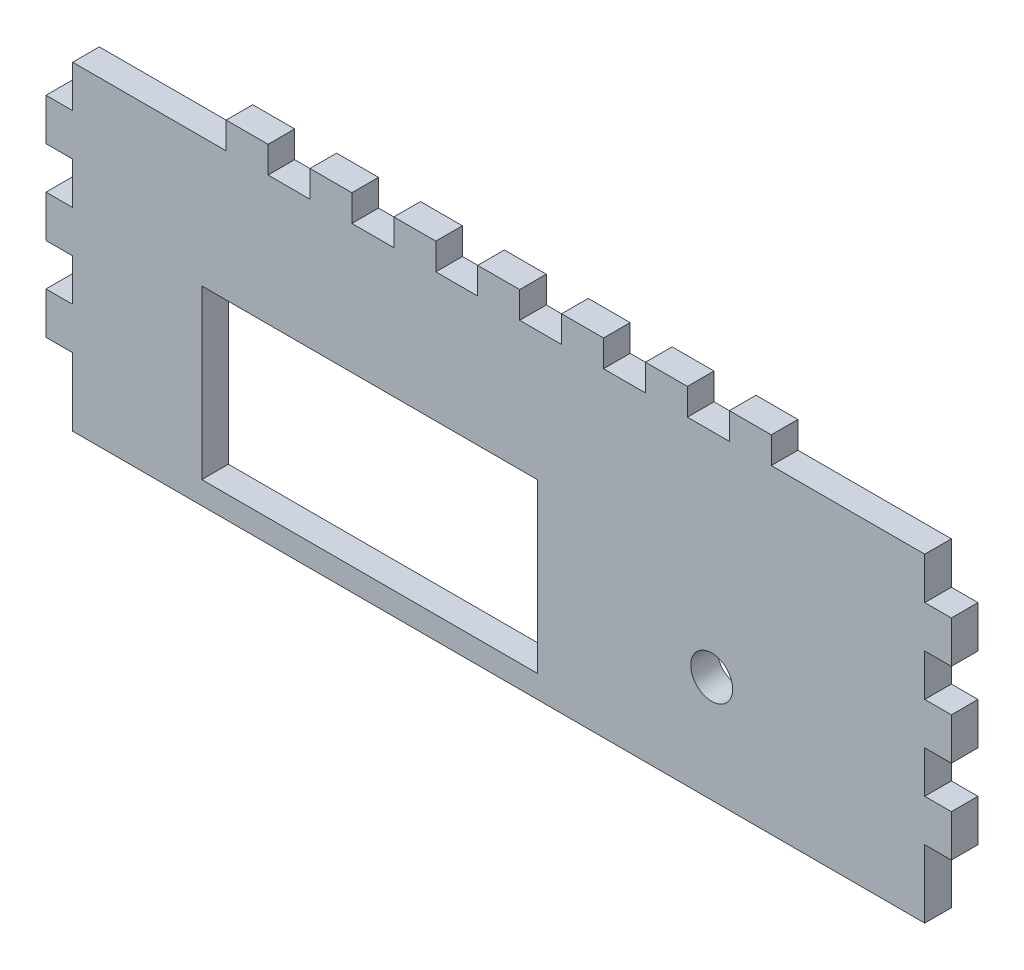
from build123d import *

# Parameters (mm, degrees)
SKETCH1_R           = 2.5
SKETCH1_W           = 40
SKETCH1_H           = 20
BOSS_EXTRUDE1_DEPTH = 3.175


with BuildPart() as part:
    # Sketch1 → Boss-Extrude1 (new body)
    with BuildSketch(Plane.XY):
        Polygon((-101.6, 0), (-83.3, 0), (-83.3, 3.175), (-78.3, 3.175), (-78.3, 0), (-73.3, 0), (-73.3, 3.175), (-68.3, 3.175), (-68.3, 0), (-63.3, 0), (-63.3, 3.175), (-58.3, 3.175), (-58.3, 0), (-53.3, 0), (-53.3, 3.175), (-48.3, 3.175), (-48.3, 0), (-43.3, 0), (-43.3, 3.175), (-38.3, 3.175), (-38.3, 0), (-33.3, 0), (-33.3, 3.175), (-28.3, 3.175), (-28.3, 0), (-23.3, 0), (-23.3, 3.175), (-18.3, 3.175), (-18.3, 0), (0, 0), (0, -5), (3.175, -5), (3.175, -10), (0, -10), (0, -15), (3.175, -15), (3.175, -20), (0, -20), (0, -25), (3.175, -25), (3.175, -30), (0, -30), (0, -38.1), (-101.6, -38.1), (-101.6, -30), (-104.775, -30), (-104.775, -25), (-101.6, -25), (-101.6, -20), (-104.775, -20), (-104.775, -15), (-101.6, -15), (-101.6, -10), (-104.775, -10), (-104.775, -5), (-101.6, -5), align=None)
        with Locations((-25.4, -25.4)):
            Circle(SKETCH1_R, mode=Mode.SUBTRACT)
        with Locations((-66.2, -25.4)):
            Rectangle(SKETCH1_W, SKETCH1_H, mode=Mode.SUBTRACT)
    extrude(amount=BOSS_EXTRUDE1_DEPTH)


solid = part.part
